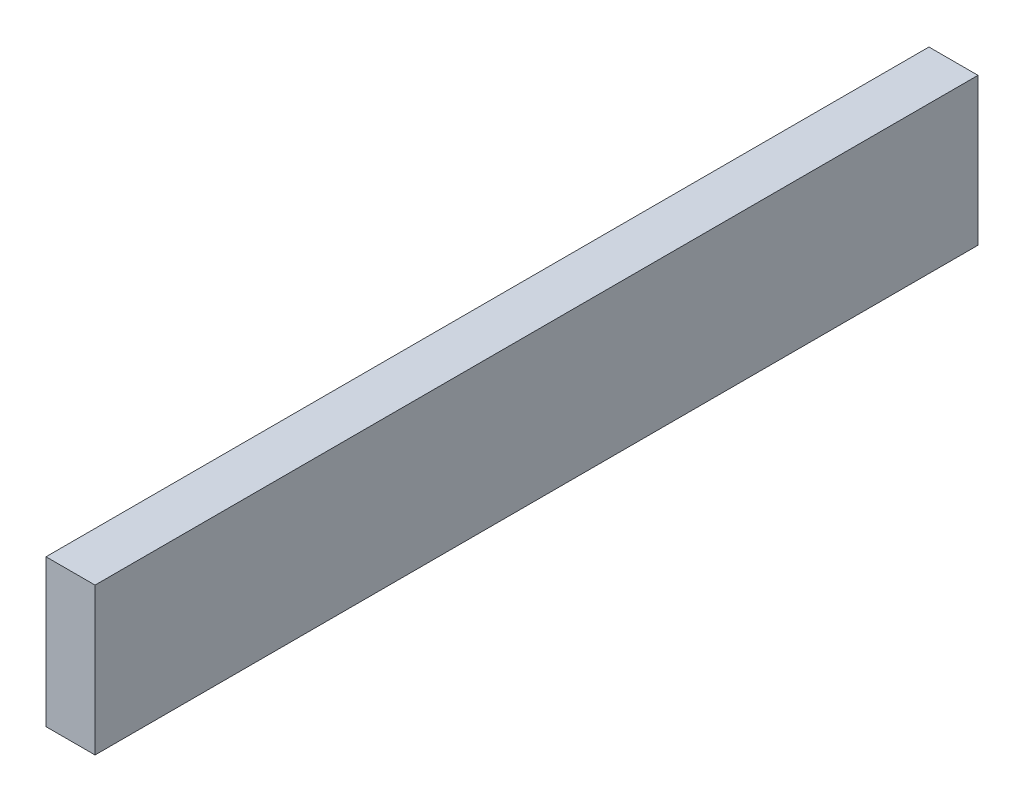
from build123d import *

# Parameters (mm, degrees)
SKETCH1_W           = 50.8
SKETCH1_H           = 152.4
BOSS_EXTRUDE1_DEPTH = 914.4


with BuildPart() as part:
    # Sketch1 → Boss-Extrude1 (new body)
    with BuildSketch(Plane.XY):
        Rectangle(SKETCH1_W, SKETCH1_H)
    extrude(amount=-BOSS_EXTRUDE1_DEPTH)


solid = part.part
